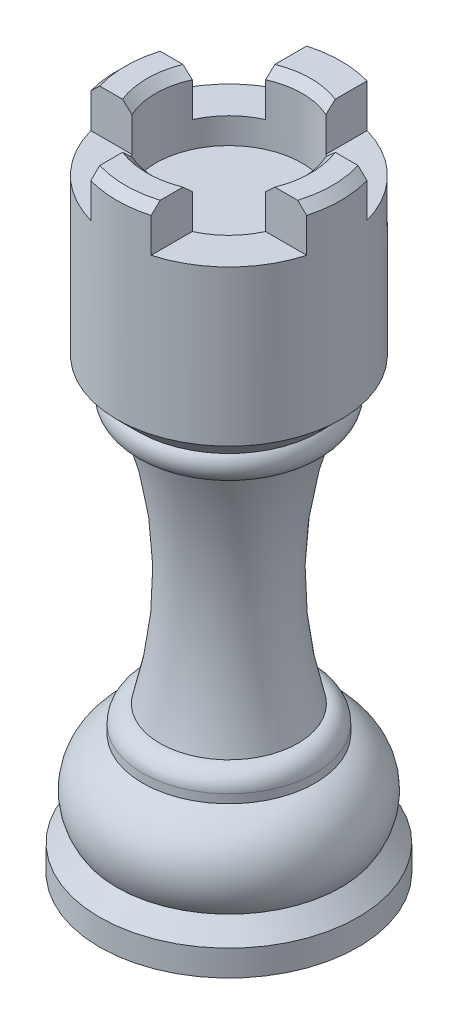
from build123d import *

# Parameters (mm, degrees)
KES_EKSTR_ZYON1_DEPTH = 5
PAH1_SIZE             = 1


with BuildPart() as part:
    # Çizim1 → Döndür1 (revolve)
    with BuildSketch(Plane.XY, mode=Mode.PRIVATE) as d_nd_r1_sk:
        with BuildLine():
            Line((0, 0), (-15, 0))
            Line((-15, 0), (-15, 3))
            Line((-15, 3), (-13, 5))
            ThreePointArc((-13, 5), (-13.688325627, 10.216881481), (-10, 13.97))
            Line((-10, 13.97), (-10, 14.97))
            ThreePointArc((-10, 14.97), (-9.414213562, 16.384213562), (-8, 16.97))
            ThreePointArc((-8, 16.97), (-6.26471847, 31.641681769), (-8.892788281, 46.18))
            ThreePointArc((-8.892788281, 46.18), (-10.800156882, 47.30566855), (-10.5, 49.5))
            Line((-10.5, 49.5), (-13, 52))
            Line((-13, 52), (-13, 70))
            Line((-13, 70), (-13, 75))
            Line((-13, 75), (-8.5, 75))
            Line((-8.5, 75), (-8.5, 70))
            Line((-8.5, 70), (-8.5, 67))
            Line((-8.5, 67), (0, 67))
            Line((0, 67), (0, 0))
        make_face()
    revolve(d_nd_r1_sk.sketch.rotate(Axis((0, 78.14654641, 0), (0, -1, 0)), 270), axis=Axis((0, 78.14654641, 0), (0, -1, 0)))

    # Çizim3 → Kes-Ekstrüzyon1 (cut)
    with BuildSketch(Plane(origin=(0, 75, 0), x_dir=(1, 0, 0), z_dir=(0, 1, 0))):
        with BuildLine():
            Line((-12.519984026, 3.5), (-7.745966692, 3.5))
            ThreePointArc((-7.745966692, 3.5), (-6.01040764, 6.01040764), (-3.5, 7.745966692))
            Line((-3.5, 7.745966692), (-3.5, 12.519984026))
            ThreePointArc((-3.5, 12.519984026), (-9.192388155, 9.192388155), (-12.519984026, 3.5))
        make_face()
        with BuildLine():
            Line((-12.519984026, -3.5), (-7.745966692, -3.5))
            ThreePointArc((-7.745966692, -3.5), (-6.01040764, -6.01040764), (-3.5, -7.745966692))
            Line((-3.5, -7.745966692), (-3.5, -12.519984026))
            ThreePointArc((-3.5, -12.519984026), (-9.192388155, -9.192388155), (-12.519984026, -3.5))
        make_face()
        with BuildLine():
            Line((7.745966692, -3.5), (12.519984026, -3.5))
            ThreePointArc((12.519984026, -3.5), (9.192388155, -9.192388155), (3.5, -12.519984026))
            Line((3.5, -12.519984026), (3.5, -7.745966692))
            ThreePointArc((3.5, -7.745966692), (6.01040764, -6.01040764), (7.745966692, -3.5))
        make_face()
        with BuildLine():
            Line((12.519984026, 3.5), (7.745966692, 3.5))
            ThreePointArc((7.745966692, 3.5), (6.01040764, 6.01040764), (3.5, 7.745966692))
            Line((3.5, 7.745966692), (3.5, 12.519984026))
            ThreePointArc((3.5, 12.519984026), (9.192388155, 9.192388155), (12.519984026, 3.5))
        make_face()
    extrude(amount=-KES_EKSTR_ZYON1_DEPTH, mode=Mode.SUBTRACT)

    # Pah1
    pah1_edges = [part.edges().sort_by_distance(p)[0] for p in [
        (13, 75, 0),
        (-13, 75, 0),
        (-1.766381565, 75, 12.879436951),
        (8.5, 75, 0),
        (0, 75, -8.5),
        (-8.5, 75, 0),
        (-1.790151267, 75, 8.309353672),
    ]]
    chamfer(pah1_edges, length=PAH1_SIZE)


solid = part.part
